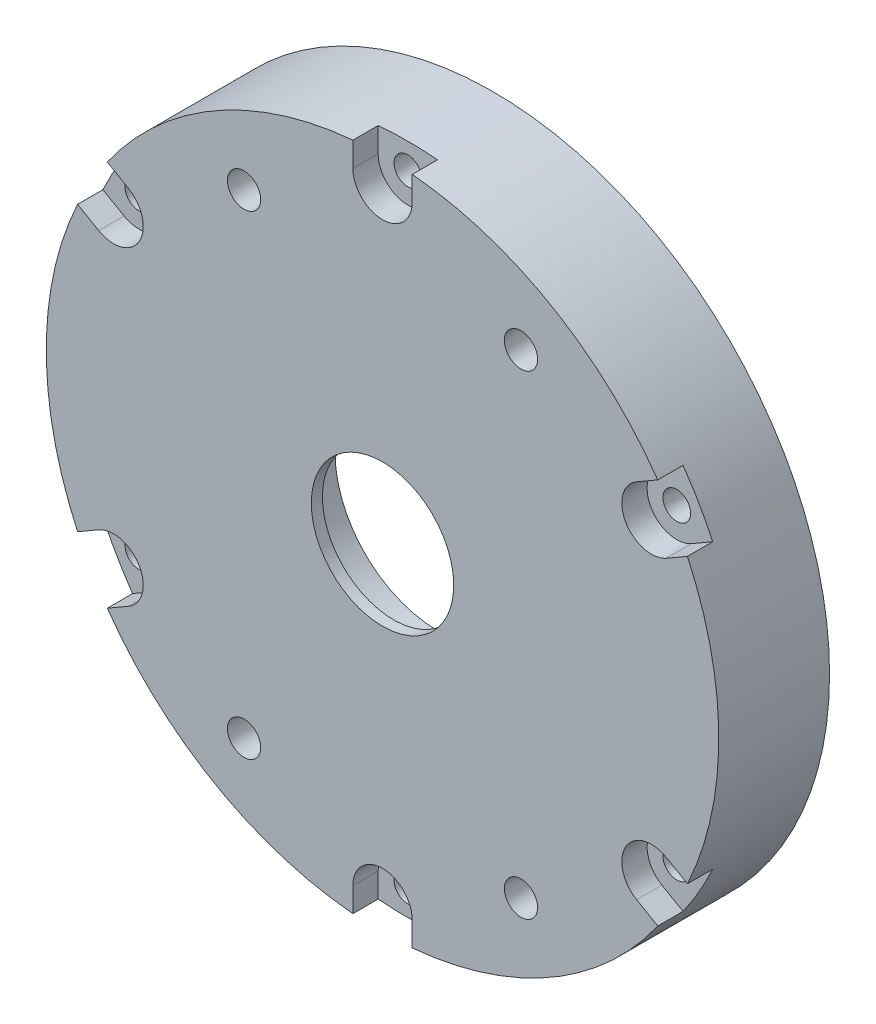
from build123d import *

# Parameters (mm, degrees)
ESBO_O1_R                = 42.5
RESSALTO_EXTRUS_O1_DEPTH = 14
CORTE_EXTRUS_O1_START    = -3.2
CORTE_EXTRUS_O1_DEPTH    = 3.2
ESBO_O5_R                = 1.75
CORTE_EXTRUS_O2_DEPTH    = 62.066684862
PADR_OCIRCULAR1_COUNT    = 6
ESBO_O6_R                = 2.1
CORTE_EXTRUS_O3_DEPTH    = 5


with BuildPart() as part:
    # Esboço1 → Ressalto-extrusão1 (new body)
    with BuildSketch(Plane.XY):
        Circle(ESBO_O1_R)
    extrude(amount=RESSALTO_EXTRUS_O1_DEPTH)

    # Esboço3 → Corte-Revolução1 (revolve, cut)
    with BuildSketch(Plane(origin=(0, 0, 0), x_dir=(1, 0, 0), z_dir=(0, 1, 0))):
        Polygon((0, 0), (0, -14), (-9, -14), (-9, -12.6), (-12, -12.6), (-12, -12), (-13, -12), (-13, -7), (-36, -7), (-36, 0), align=None)
    revolve(axis=Axis((0, 0, 0), (0, 0, 1)), mode=Mode.SUBTRACT)

    # Esboço4 → Corte-extrusão1 (cut)
    with BuildSketch(Plane.XY.offset(14).offset(CORTE_EXTRUS_O1_START)):
        with BuildLine():
            Line((-3.75, 39.25), (-3.75, 42.334235555))
            ThreePointArc((-3.75, 42.334235555), (0, 42.5), (3.75, 42.334235555))
            Line((3.75, 42.334235555), (3.75, 39.25))
            ThreePointArc((3.75, 39.25), (0, 35.5), (-3.75, 39.25))
        make_face()
    corte_extrus_o1 = extrude(amount=CORTE_EXTRUS_O1_DEPTH, mode=Mode.SUBTRACT)

    # Esboço5 → Corte-extrusão2 (cut, through all)
    with BuildSketch(Plane.XY.offset(10.8)):
        with Locations((0, 39.25)):
            Circle(ESBO_O5_R)
    corte_extrus_o2 = extrude(amount=-CORTE_EXTRUS_O2_DEPTH, mode=Mode.SUBTRACT)

    # PadrãoCircular1: Corte-extrusão1, Corte-extrusão2 ×6 about axis
    padr_ocircular1_axis = Axis((0, 0, 0), (0, 0, 1))
    add([corte_extrus_o1.rotate(padr_ocircular1_axis, i * 360 / PADR_OCIRCULAR1_COUNT) for i in range(1, PADR_OCIRCULAR1_COUNT)], mode=Mode.SUBTRACT)
    add([corte_extrus_o2.rotate(padr_ocircular1_axis, i * 360 / PADR_OCIRCULAR1_COUNT) for i in range(1, PADR_OCIRCULAR1_COUNT)], mode=Mode.SUBTRACT)

    # Esboço6 → Corte-extrusão3 (cut)
    with BuildSketch(Plane.XY.offset(14)):
        with Locations((-17.5, 30)):
            Circle(ESBO_O6_R)
        with Locations((17.5, 30)):
            Circle(ESBO_O6_R)
        with Locations((17.5, -30)):
            Circle(ESBO_O6_R)
        with Locations((-17.5, -30)):
            Circle(ESBO_O6_R)
    extrude(amount=-CORTE_EXTRUS_O3_DEPTH, mode=Mode.SUBTRACT)


solid = part.part
